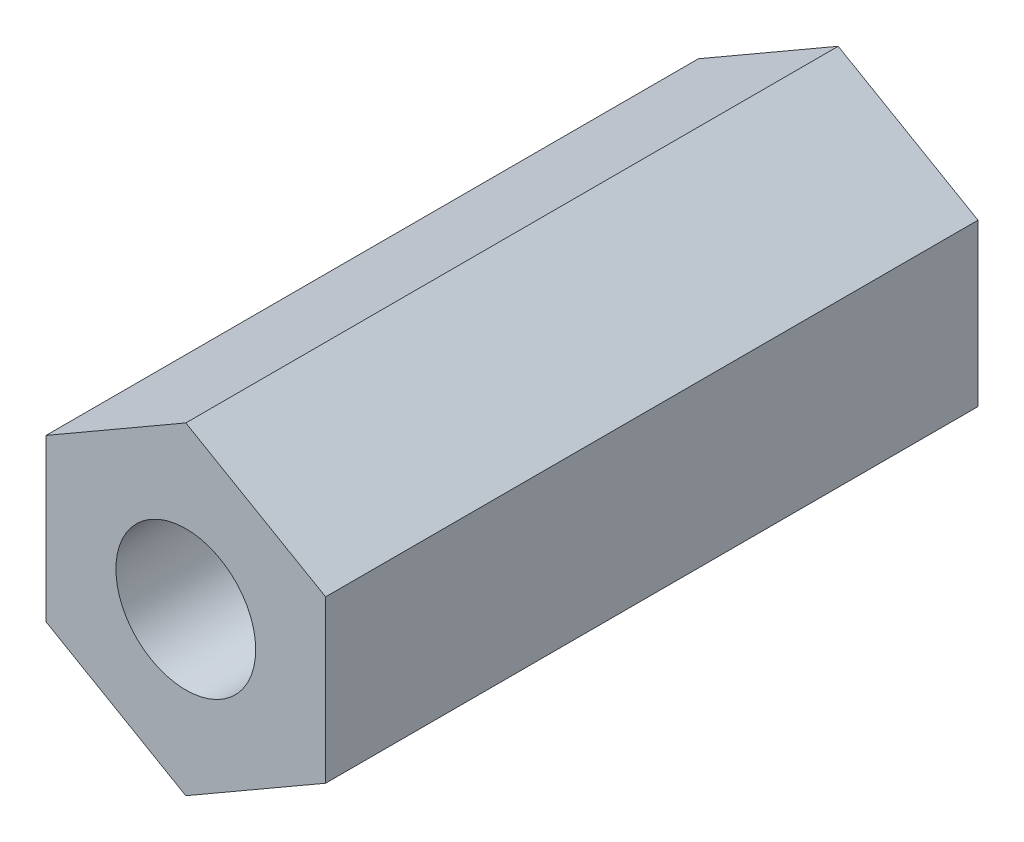
from build123d import *

# Parameters (mm, degrees)
EXTRUDE1_DEPTH      = 7
EXTRUDE1_DEPTH_BACK = 7
SKETCH1_R           = 1.5


with BuildPart() as part:
    # Sketch1 → Extrude1 (new, two sides: drawn at the far end of the back side and taken through both)
    with BuildSketch(Plane.XY.offset(-EXTRUDE1_DEPTH_BACK)):
        Polygon((0, 3.464101615), (-3, 1.732050808), (-3, -1.732050808), (0, -3.464101615), (3, -1.732050808), (3, 1.732050808), align=None)
        Circle(SKETCH1_R, mode=Mode.SUBTRACT)
    extrude(amount=EXTRUDE1_DEPTH + EXTRUDE1_DEPTH_BACK)


solid = part.part
